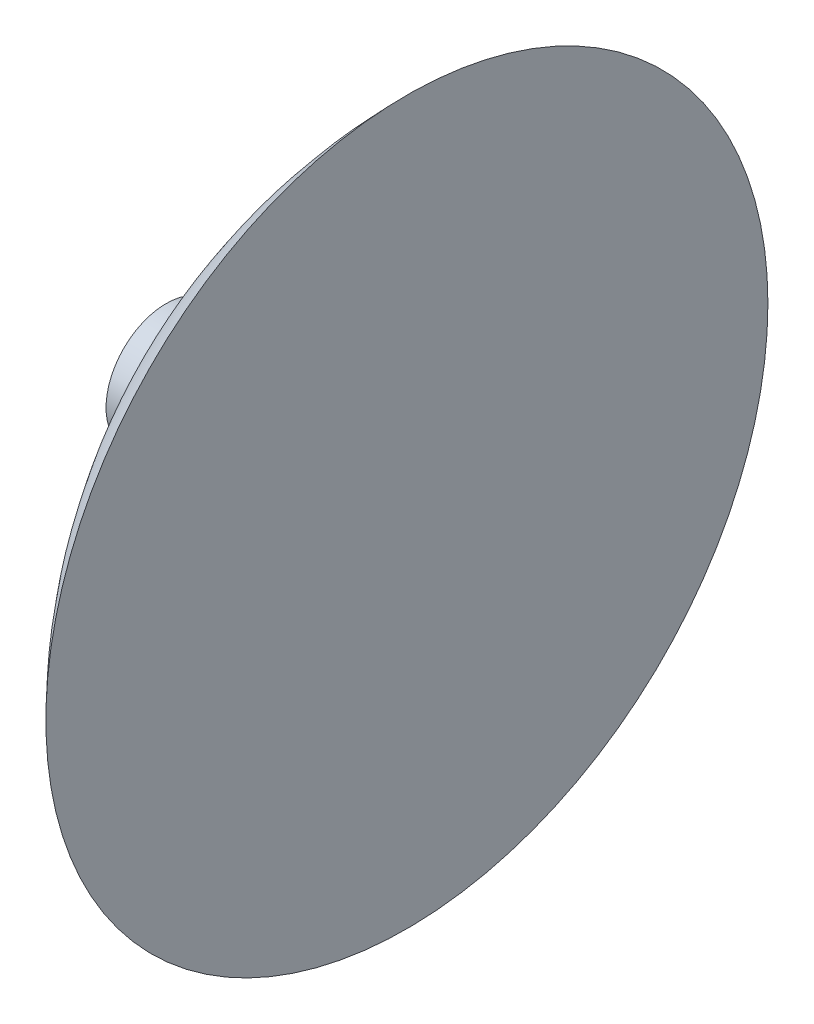
from build123d import *

# Parameters (mm, degrees)
SKETCH2_R           = 125
BOSS_EXTRUDE1_DEPTH = 500


with BuildPart() as part:
    # Sketch1 → Revolve1 (revolve)
    with BuildSketch(Plane(origin=(0, 0, 0), x_dir=(1, 0, 0), z_dir=(0, 1, 0))):
        with BuildLine():
            Line((-750, 750), (-750, 0))
            Line((-750, 0), (-1060.66017178, 0))
            ThreePointArc((-1060.66017178, 0), (-979.922223657, 405.89707511), (-750, 750))
        make_face()
    revolve(axis=Axis((-1110.59399243, 0, 0), (1, 0, 0)))

    # Sketch2 → Boss-Extrude1 (add)
    with BuildSketch(Plane(origin=(-750, 0, 0), x_dir=(0, 0, -1), z_dir=(1, 0, 0))):
        Circle(SKETCH2_R)
    extrude(amount=-BOSS_EXTRUDE1_DEPTH)


solid = part.part
